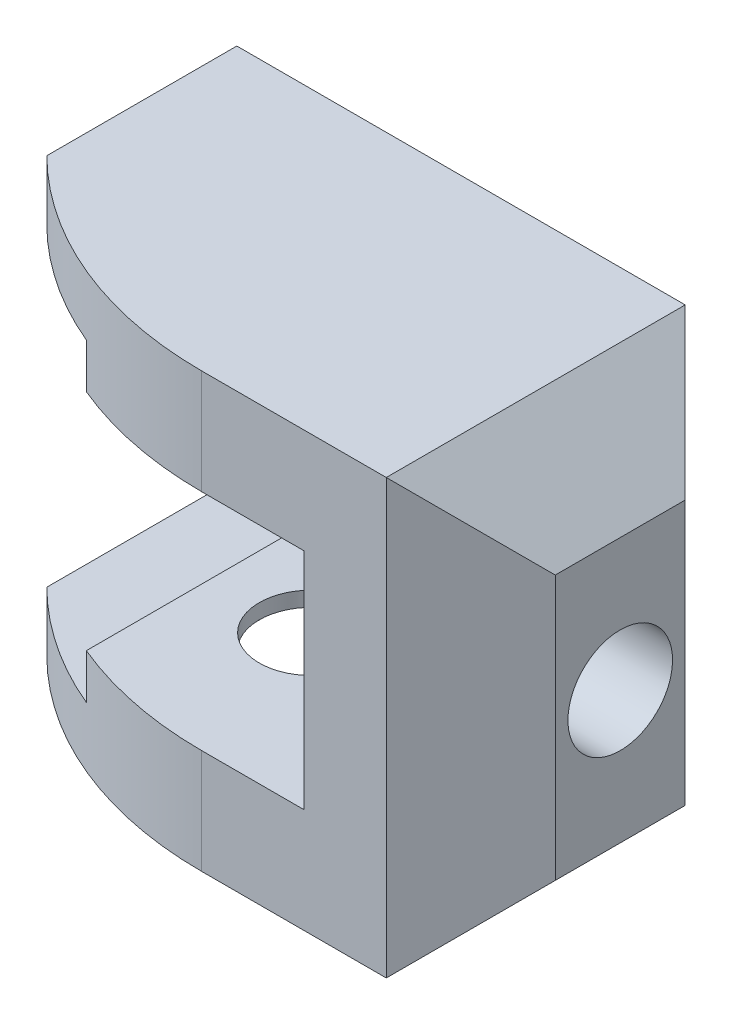
from build123d import *

# Parameters (mm, degrees)
BOSS_EXTRUDE1_DEPTH = 40
CUT_EXTRUDE2_DEPTH  = 101.242224803
CUT_EXTRUDE3_DEPTH  = 101.242224803
SKETCH14_R          = 7
CUT_EXTRUDE4_DEPTH  = 101.242224803
CUT_EXTRUDE5_REACH  = 102.242
SKETCH15_R          = 7
SKETCH16_R          = 7
CUT_EXTRUDE6_DEPTH  = 2
CUT_EXTRUDE9_DEPTH  = 6
SKETCH22_W          = 41.976716328
SKETCH22_H          = 31.966333102
CUT_EXTRUDE11_DEPTH = 6
CUT_EXTRUDE12_DEPTH = 6


with BuildPart() as part:
    # Sketch2 → Boss-Extrude1 (new body)
    with BuildSketch(Plane.XY):
        Polygon((60, 58), (71.305705476, 46.694294524), (71.305705476, 11.305705476), (60, 0), (0, 0), (0, 8), (16, 8), (16, 14), (49, 14), (49, 44), (45.974238177, 44), (16, 44), (16, 50), (0, 50), (0, 58), align=None)
    extrude(amount=BOSS_EXTRUDE1_DEPTH)

    # Sketch4 → Cut-Extrude2 (cut, through all)
    with BuildSketch(Plane.XZ):
        with BuildLine():
            Line((0, 25.426887123), (0, 40))
            Line((0, 40), (35.283645911, 40))
            ThreePointArc((35.283645911, 40), (16.196272547, 36.213333337), (0, 25.426887123))
        make_face()
    extrude(amount=-CUT_EXTRUDE2_DEPTH, mode=Mode.SUBTRACT)

    # Sketch12 → Cut-Extrude3 (cut, through all)
    with BuildSketch(Plane(origin=(0, 0, 0), x_dir=(1, 0, 0), z_dir=(0, 1, 0))):
        Polygon((60, 0), (71.305705476, -11.305705476), (71.305705476, 0), align=None)
        Polygon((60, -40), (71.305705476, -28.694294524), (71.305705476, -40), align=None)
    extrude(amount=CUT_EXTRUDE3_DEPTH, mode=Mode.SUBTRACT)

    # Sketch14 → Cut-Extrude4 (cut, through all)
    with BuildSketch(Plane(origin=(71.305705476, 0, 0), x_dir=(0, 0, -1), z_dir=(1, 0, 0))):
        with Locations(Location((-20, 29, 0), (0, 0, 90))):
            Circle(SKETCH14_R)
    extrude(amount=-CUT_EXTRUDE4_DEPTH, mode=Mode.SUBTRACT)

    # Sketch15 → Cut-Extrude5 (cut, up to next)
    with BuildSketch(Plane.XZ, mode=Mode.PRIVATE) as cut_extrude5_sk1:
        with Locations(Location((29, 19, 0), (0, 0, 270))):
            Circle(SKETCH15_R)
    cut_extrude5_tool1 = extrude(cut_extrude5_sk1.sketch, amount=-CUT_EXTRUDE5_REACH, mode=Mode.PRIVATE) & part.part
    add(cut_extrude5_tool1.solids().sort_by_distance((29, 0, 19))[0], mode=Mode.SUBTRACT)

    # Sketch16 → Cut-Extrude6 (cut)
    with BuildSketch(Plane.XZ.offset(-44)):
        with Locations(Location((29, 19, 0), (0, 0, 270))):
            Circle(SKETCH16_R)
    extrude(amount=-CUT_EXTRUDE6_DEPTH, mode=Mode.SUBTRACT)

    # Sketch21 → Cut-Extrude9 (cut)
    with BuildSketch(Plane.XZ):
        with BuildLine():
            Line((0, 22.543268601), (0, 2))
            Line((0, 2), (58, 2))
            Line((58, 2), (58, 38))
            Line((58, 38), (35.283645911, 38))
            ThreePointArc((35.283645911, 38), (16.023283672, 33.966333102), (0, 22.543268601))
        make_face()
    extrude(amount=-CUT_EXTRUDE9_DEPTH, mode=Mode.SUBTRACT)

    # Sketch22 → Cut-Extrude11 (cut)
    with BuildSketch(Plane.XZ.offset(-6)):
        with Locations((37.011641836, 17.983166551)):
            Rectangle(SKETCH22_W, SKETCH22_H)
    extrude(amount=-CUT_EXTRUDE11_DEPTH, mode=Mode.SUBTRACT)

    # Sketch23 → Cut-Extrude12 (cut)
    with BuildSketch(Plane.XZ.offset(-6)):
        with BuildLine():
            Line((16.023283672, 33.966333102), (58, 33.966333102))
            Line((58, 33.966333102), (58, 38))
            Line((58, 38), (34.032069155, 37.983680097))
            ThreePointArc((34.032069155, 37.983680097), (24.80704409, 36.964047425), (16.023283672, 33.966333102))
        make_face()
    extrude(amount=-CUT_EXTRUDE12_DEPTH, mode=Mode.SUBTRACT)


solid = part.part
